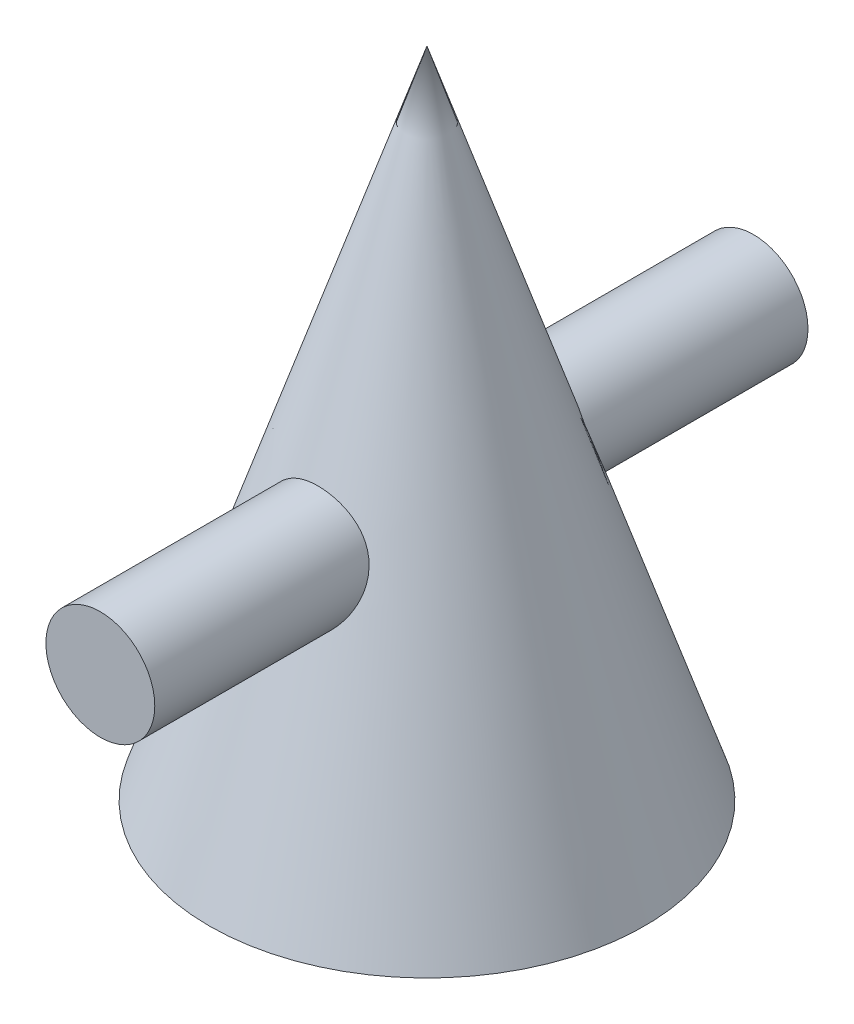
from build123d import *

# Parameters (mm, degrees)
SKETCH_1_R           = 20
EXTRUDE_1_DEPTH      = 30
EXTRUDE_1_DEPTH_BACK = 30
SKETCH_3_R           = 5


with BuildPart() as part:
    # 草图1 → 放样1 section 0
    with BuildSketch(Plane(origin=(0, 0, 0), x_dir=(1, 0, 0), z_dir=(0, 1, 0)), mode=Mode.PRIVATE) as loft_1_s0:
        Circle(SKETCH_1_R)
    loft([Vertex(0, 60, 0), loft_1_s0.sketch])

    # 草图3 → 凸台-拉伸1 (add, two sides: drawn at the far end of the back side and taken through both)
    with BuildSketch(Plane.XY.offset(-EXTRUDE_1_DEPTH_BACK)):
        with Locations((0, 25)):
            Circle(SKETCH_3_R)
    extrude(amount=EXTRUDE_1_DEPTH + EXTRUDE_1_DEPTH_BACK)


solid = part.part
